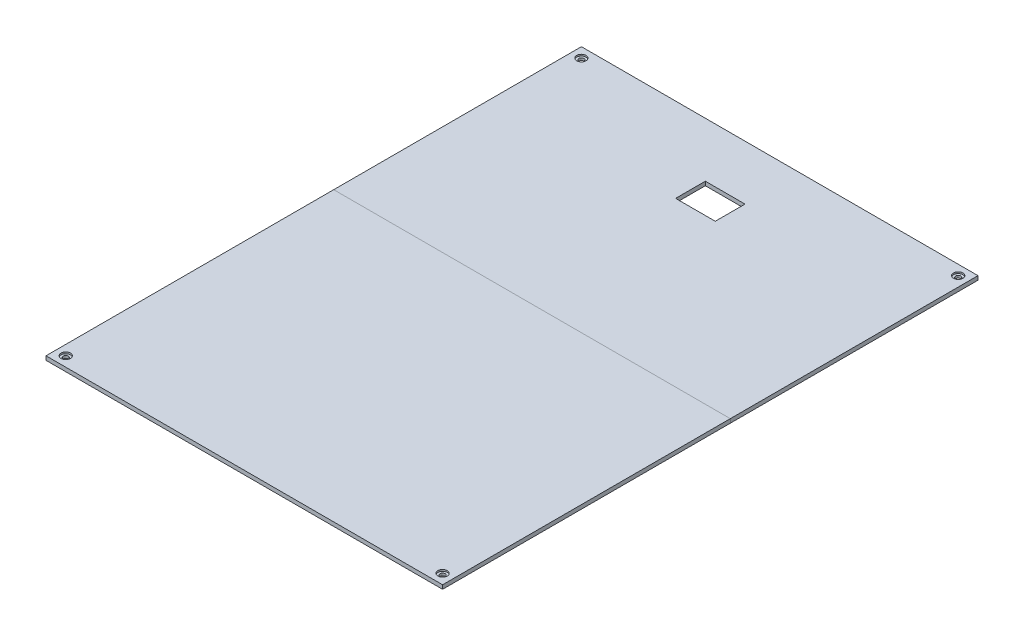
from build123d import *

# Parameters (mm, degrees)
SKETCH_1_W          = 200
SKETCH_1_H          = 270
EXTRUDE_1_DEPTH     = 2
SKETCH_2_R          = 1.3
CUT_EXTRUDE_1_DEPTH = 169.014880293
SKETCH_3_R          = 2.375
CUT_EXTRUDE_2_DEPTH = 0.8
SKETCH_4_W          = 20
SKETCH_4_H          = 15
CUT_EXTRUDE_3_DEPTH = 169.014880293
SKETCH_5_R          = 2.75
SKETCH_5_R_2        = 1.75
EXTRUDE_2_DEPTH     = 2.7


with BuildPart() as part:
    # Эскиз1 → Бобышка-Вытянуть1 (new body)
    with BuildSketch(Plane(origin=(0, 0, 0), x_dir=(1, 0, 0), z_dir=(0, 1, 0))):
        Rectangle(SKETCH_1_W, SKETCH_1_H)
    extrude(amount=EXTRUDE_1_DEPTH)

    # Эскиз2 → Вырез-Вытянуть1 (cut, through all)
    with BuildSketch(Plane(origin=(0, 2, 0), x_dir=(1, 0, 0), z_dir=(0, 1, 0))):
        with Locations(Location((-95.01023, 130.01023, 0), (0, 0, 270))):
            Circle(SKETCH_2_R)
        with Locations(Location((95.01023, 130.01023, 0), (0, 0, 90))):
            Circle(SKETCH_2_R)
        with Locations(Location((95.01023, -130.01023, 0), (0, 0, 270))):
            Circle(SKETCH_2_R)
        with Locations(Location((-95.01023, -130.01023, 0), (0, 0, 90))):
            Circle(SKETCH_2_R)
    extrude(amount=-CUT_EXTRUDE_1_DEPTH, mode=Mode.SUBTRACT)

    # Эскиз3 → Вырез-Вытянуть2 (cut)
    with BuildSketch(Plane(origin=(0, 2, 0), x_dir=(1, 0, 0), z_dir=(0, 1, 0))):
        with Locations(Location((-95.01023, 130.01023, 0), (0, 0, 270))):
            Circle(SKETCH_3_R)
        with Locations(Location((95.01023, 130.01023, 0), (0, 0, 270))):
            Circle(SKETCH_3_R)
        with Locations(Location((-95.01023, -130.01023, 0), (0, 0, 270))):
            Circle(SKETCH_3_R)
        with Locations(Location((95.01023, -130.01023, 0), (0, 0, 270))):
            Circle(SKETCH_3_R)
    extrude(amount=-CUT_EXTRUDE_2_DEPTH, mode=Mode.SUBTRACT)

    # Эскиз4 → Вырез-Вытянуть3 (cut, through all)
    with BuildSketch(Plane(origin=(0, 2, 0), x_dir=(1, 0, 0), z_dir=(0, 1, 0))):
        with Locations((0, 100)):
            Rectangle(SKETCH_4_W, SKETCH_4_H)
    extrude(amount=-CUT_EXTRUDE_3_DEPTH, mode=Mode.SUBTRACT)

    # Эскиз5 → Бобышка-Вытянуть2 (add)
    # profile 1 of 2: a face of its own
    with BuildSketch(Plane.XZ):
        with Locations(Location((-3.9, -120.15, 0), (0, 0, 90))):
            Circle(SKETCH_5_R)
        with Locations(Location((-3.9, -120.15, 0), (0, 0, 90))):
            Circle(SKETCH_5_R_2, mode=Mode.SUBTRACT)
    # profile 2 of 2: a face of its own
    with BuildSketch(Plane.XZ):
        with Locations(Location((6.25, -88.45, 0), (0, 0, 90))):
            Circle(SKETCH_5_R)
        with Locations(Location((6.25, -88.45, 0), (0, 0, 90))):
            Circle(SKETCH_5_R_2, mode=Mode.SUBTRACT)
    extrude(amount=EXTRUDE_2_DEPTH)


with BuildPart() as body_2:
    # Split Bodies 1: the piece on the far side of the plane
    add(part.part)
    split(bisect_by=Plane(origin=(0, 0, -10.0835), x_dir=(-1, 0, 0), z_dir=(0, 0, -1)), keep=Keep.BOTTOM)


with BuildPart() as part_1:
    add(part.part)

    # Split Bodies 1
    split(bisect_by=Plane(origin=(0, 0, -10.0835), x_dir=(-1, 0, 0), z_dir=(0, 0, -1)), keep=Keep.TOP)


solid = Compound([body_2.part, part_1.part])
